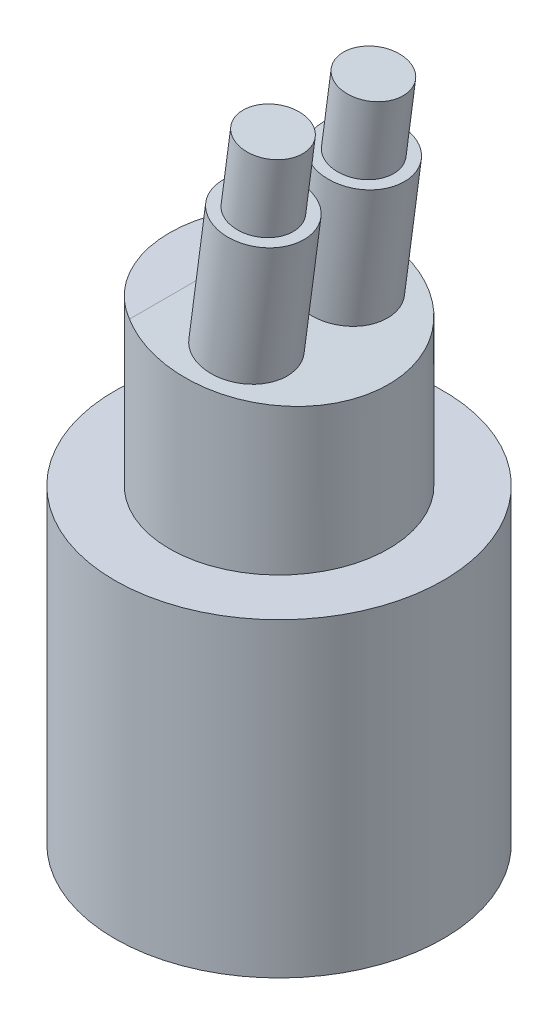
from build123d import *

# Parameters (mm, degrees)
SKETCH1_R           = 9
BOSS_EXTRUDE1_DEPTH = 17
SKETCH2_R           = 6
BOSS_EXTRUDE2_DEPTH = 9
CUT_EXTRUDE1_DEPTH  = 8.5
SKETCH4_R           = 2.25
BOSS_EXTRUDE3_DEPTH = 11
CUT_EXTRUDE2_START  = -4
SKETCH5_R           = 2.25
SKETCH5_R_2         = 1.65
CUT_EXTRUDE2_DEPTH  = 4
SKETCH6_R           = 2.05
CUT_EXTRUDE3_DEPTH  = 5


with BuildPart() as part:
    # Sketch1 → Boss-Extrude1 (new body)
    with BuildSketch(Plane(origin=(0, 0, 0), x_dir=(1, 0, 0), z_dir=(0, 1, 0))):
        with Locations(Location((0, 0, 0), (0, 0, 270))):
            Circle(SKETCH1_R)
    extrude(amount=BOSS_EXTRUDE1_DEPTH)

    # Sketch2 → Boss-Extrude2 (add)
    with BuildSketch(Plane(origin=(0, 17, 0), x_dir=(1, 0, 0), z_dir=(0, 1, 0))):
        with Locations(Location((0, 0, 0), (0, 0, 270))):
            Circle(SKETCH2_R)
    extrude(amount=BOSS_EXTRUDE2_DEPTH)

    # Sketch3 → Cut-Extrude1 (cut, symmetric)
    with BuildSketch(Plane.XY):
        Polygon((-3, 26), (6, 26), (6, 24.8), align=None)
    extrude(amount=CUT_EXTRUDE1_DEPTH, both=True, mode=Mode.SUBTRACT)

    # Sketch4 → Boss-Extrude3 (add)
    with BuildSketch(Plane(origin=(3.35371179, 25.152838428, 0), x_dir=(0.9912279006826347, -0.13216372009101796, 0), z_dir=(0.13216372009101796, 0.9912279006826347, 0))):
        with Locations((-2.409940424, 2.75)):
            Circle(SKETCH4_R)
        with Locations((-2.409940424, -2.75)):
            Circle(SKETCH4_R)
    extrude(amount=BOSS_EXTRUDE3_DEPTH)

    # Sketch5 → Cut-Extrude2 (cut)
    # profile 1 of 2: a face of its own
    with BuildSketch(Plane(origin=(4.807512711, 36.056345335, 0), x_dir=(0.9912279006826347, -0.13216372009101796, 0), z_dir=(0.13216372009101796, 0.9912279006826347, 0)).offset(CUT_EXTRUDE2_START)):
        with Locations((-2.409940424, 2.75)):
            Circle(SKETCH5_R)
        with Locations(Location((-2.409940424, 2.75, 0), (0, 0, 180))):
            Circle(SKETCH5_R_2, mode=Mode.SUBTRACT)
    # profile 2 of 2: a face of its own
    with BuildSketch(Plane(origin=(4.807512711, 36.056345335, 0), x_dir=(0.9912279006826347, -0.13216372009101796, 0), z_dir=(0.13216372009101796, 0.9912279006826347, 0)).offset(CUT_EXTRUDE2_START)):
        with Locations((-2.409940424, -2.75)):
            Circle(SKETCH5_R)
        with Locations(Location((-2.409940424, -2.75, 0), (0, 0, 180))):
            Circle(SKETCH5_R_2, mode=Mode.SUBTRACT)
    extrude(amount=CUT_EXTRUDE2_DEPTH, mode=Mode.SUBTRACT)

    # Sketch6 → Cut-Extrude3 (cut)
    with BuildSketch(Plane.XZ):
        with Locations(Location((0, 0, 0), (0, 0, 270))):
            Circle(SKETCH6_R)
    extrude(amount=-CUT_EXTRUDE3_DEPTH, mode=Mode.SUBTRACT)


solid = part.part
